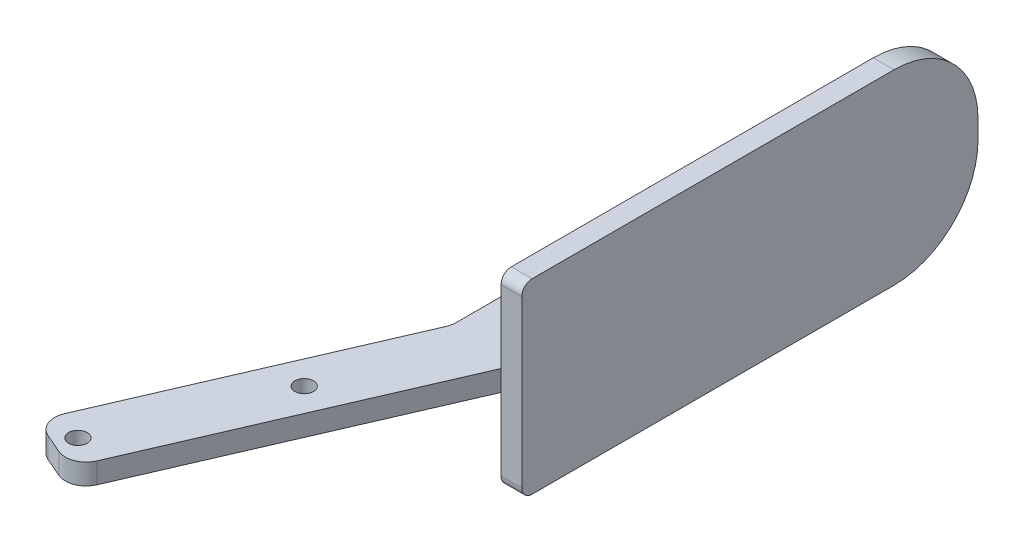
from build123d import *

# Parameters (mm, degrees)
SKETCH1_W           = 69.85
SKETCH1_H           = 28.575
BOSS_EXTRUDE1_DEPTH = 3.175
FILLET1_R           = 12.8524
BOSS_EXTRUDE2_DEPTH = 1.5875
FILLET2_R           = 1.5875
FILLET3_R           = 3.175
HOLE1_D             = 2.8448
LPATTERN1_COUNT     = 2
LPATTERN1_PITCH     = 26.3525


with BuildPart() as part:
    # Sketch1 → Boss-Extrude1 (new body)
    with BuildSketch(Plane(origin=(0, 0, 0), x_dir=(0, 0, -1), z_dir=(1, 0, 0))):
        with Locations((34.925, 0)):
            Rectangle(SKETCH1_W, SKETCH1_H)
    extrude(amount=BOSS_EXTRUDE1_DEPTH)

    # Fillet1
    fillet1_edges = [part.edges().sort_by_distance(p)[0] for p in [
        (1.5875, 14.2875, -69.85),
        (1.5875, -14.2875, -69.85),
    ]]
    fillet(fillet1_edges, radius=FILLET1_R)

    # Sketch4 → Boss-Extrude2 (add, symmetric)
    with BuildSketch(Plane(origin=(0, 0, 0), x_dir=(1, 0, 0), z_dir=(0, 1, 0))):
        Polygon((0, 0), (-19.950179226, -46.101), (-28.691757819, -42.318087272), (-9.525, 1.972577598), (-9.525, 55.499), (0, 55.499), align=None)
    extrude(amount=BOSS_EXTRUDE2_DEPTH, both=True)

    # Fillet2
    fillet2_edges = [part.edges().sort_by_distance(p)[0] for p in [
        (1.5875, -14.2875, 0),
        (1.5875, 14.2875, 0),
    ]]
    fillet(fillet2_edges, radius=FILLET2_R)

    # Fillet3
    fillet3_edges = [part.edges().sort_by_distance(p)[0] for p in [
        (-9.525, 0, -55.499),
        (-9.525, 0, -1.972577598),
        (-19.950179226, 0, 46.101),
        (-28.691757819, 0, 42.318087272),
    ]]
    fillet(fillet3_edges, radius=FILLET3_R)

    # Hole1 (through all)
    with Locations(Plane(origin=(0, 1.5875, 0), x_dir=(-1, 0, 0), z_dir=(0, 1, 0))):
        with Locations((23.191138588, 41.598725496)):
            hole1 = Hole(HOLE1_D / 2)

    # LPattern1: Hole1 ×2
    with Locations(*[Vector(0.3971561918635808, 0, -0.9177510333769276) * (i * LPATTERN1_PITCH) for i in range(1, LPATTERN1_COUNT)]):
        add(hole1, mode=Mode.SUBTRACT)


solid = part.part
